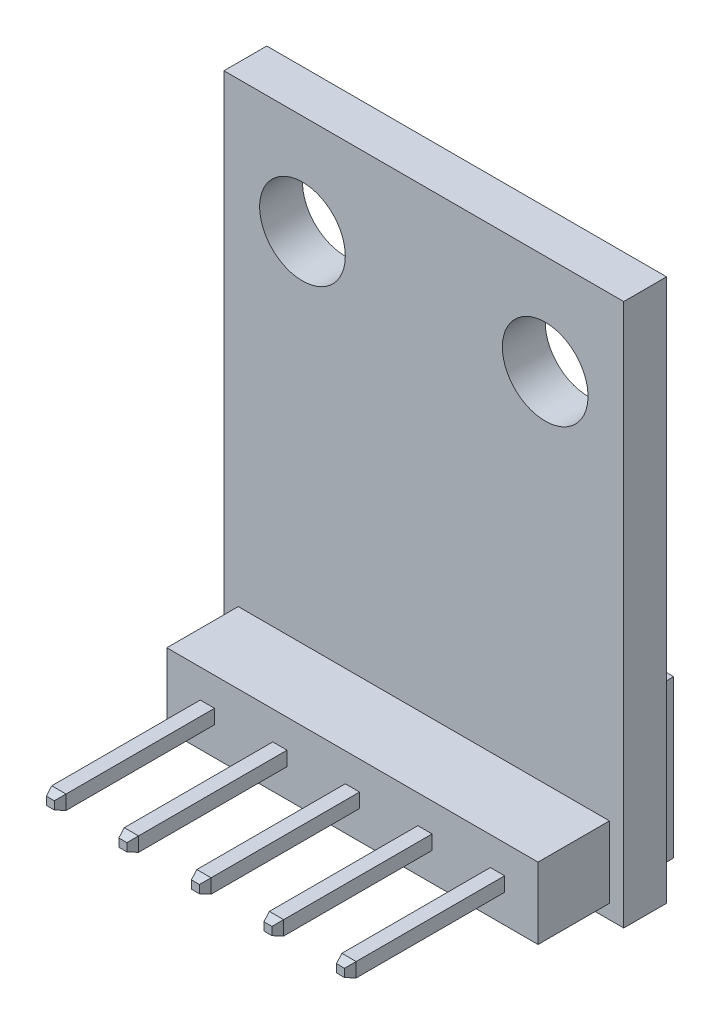
from build123d import *
from OCP.BRepFilletAPI import BRepFilletAPI_MakeChamfer

# Parameters (mm, degrees)
SKETCH2_W                     = 14
SKETCH2_H                     = 19
BOSS_EXTRUDE1_DEPTH           = 1.5
SKETCH3_R                     = 1.5
CUT_EXTRUDE1_DEPTH            = 12.895377253
SKETCH4_W                     = 13
SKETCH4_H                     = 2.5
BOSS_EXTRUDE2_DEPTH           = 2.5
SKETCH5_W                     = 0.5
SKETCH5_H                     = 0.5
BOSS_EXTRUDE3_DEPTH           = 5.5
CHAMFER1_SIZE                 = 0.3
CHAMFER1_SIZE2                = 0.10919107
SKETCH6_W                     = 12.5
SKETCH6_H                     = 5.5
SKETCH6_W_2                   = 4.5
SKETCH6_H_2                   = 1.5
SKETCH6_W_3                   = 2.5
SKETCH6_H_3                   = 1
KOPONENTTIEN_TILAVARAUS_DEPTH = 1


with BuildPart() as part:
    # Sketch2 → Boss-Extrude1 (new body)
    with BuildSketch(Plane.XY):
        Rectangle(SKETCH2_W, SKETCH2_H)
    extrude(amount=BOSS_EXTRUDE1_DEPTH)

    # Sketch3 → Cut-Extrude1 (cut, through all)
    with BuildSketch(Plane.XY.offset(1.5)):
        with Locations((-4.25, 6)):
            Circle(SKETCH3_R)
        with Locations(Location((4.25, 6, 0), (0, 0, 180))):
            Circle(SKETCH3_R)
    extrude(amount=-CUT_EXTRUDE1_DEPTH, mode=Mode.SUBTRACT)

    # Sketch4 → Boss-Extrude2 (add)
    with BuildSketch(Plane.XY.offset(1.5)):
        with Locations((0, -7.75)):
            Rectangle(SKETCH4_W, SKETCH4_H)
    extrude(amount=BOSS_EXTRUDE2_DEPTH)

    # Sketch5 → Boss-Extrude3 (add)
    with BuildSketch(Plane.XY.offset(4)):
        with Locations((-5.08, -7.75)):
            Rectangle(SKETCH5_W, SKETCH5_H)
        with Locations((-2.54, -7.75)):
            Rectangle(SKETCH5_W, SKETCH5_H)
        with Locations((0, -7.75)):
            Rectangle(SKETCH5_W, SKETCH5_H)
        with Locations((2.54, -7.75)):
            Rectangle(SKETCH5_W, SKETCH5_H)
        with Locations((5.08, -7.75)):
            Rectangle(SKETCH5_W, SKETCH5_H)
    extrude(amount=BOSS_EXTRUDE3_DEPTH)

    # Chamfer1: one chamfer whose edges measure the first distance from different faces: ONE call of the kernel's chamfer builder (chamfer() names one face for all edges)
    chamfer1_edges_1 = [part.edges().sort_by_distance(p)[0] for p in [
        (-4.83, -7.75, 9.5),
    ]]
    chamfer1_side_1 = [part.faces().sort_by_distance(p)[0] for p in [
        (-4.83, -7.75, 6.75),
    ]]
    chamfer1_edges_2 = [part.edges().sort_by_distance(p)[0] for p in [
        (-5.08, -7.5, 9.5),
    ]]
    chamfer1_side_2 = [part.faces().sort_by_distance(p)[0] for p in [
        (-5.08, -7.5, 6.75),
    ]]
    chamfer1_edges_3 = [part.edges().sort_by_distance(p)[0] for p in [
        (-5.33, -7.75, 9.5),
    ]]
    chamfer1_side_3 = [part.faces().sort_by_distance(p)[0] for p in [
        (-5.33, -7.75, 6.75),
    ]]
    chamfer1_edges_4 = [part.edges().sort_by_distance(p)[0] for p in [
        (-5.08, -8, 9.5),
    ]]
    chamfer1_side_4 = [part.faces().sort_by_distance(p)[0] for p in [
        (-5.08, -8, 6.75),
    ]]
    chamfer1_edges_5 = [part.edges().sort_by_distance(p)[0] for p in [
        (-2.29, -7.75, 9.5),
    ]]
    chamfer1_side_5 = [part.faces().sort_by_distance(p)[0] for p in [
        (-2.29, -7.75, 6.75),
    ]]
    chamfer1_edges_6 = [part.edges().sort_by_distance(p)[0] for p in [
        (-2.54, -7.5, 9.5),
    ]]
    chamfer1_side_6 = [part.faces().sort_by_distance(p)[0] for p in [
        (-2.54, -7.5, 6.75),
    ]]
    chamfer1_edges_7 = [part.edges().sort_by_distance(p)[0] for p in [
        (-2.79, -7.75, 9.5),
    ]]
    chamfer1_side_7 = [part.faces().sort_by_distance(p)[0] for p in [
        (-2.79, -7.75, 6.75),
    ]]
    chamfer1_edges_8 = [part.edges().sort_by_distance(p)[0] for p in [
        (-2.54, -8, 9.5),
    ]]
    chamfer1_side_8 = [part.faces().sort_by_distance(p)[0] for p in [
        (-2.54, -8, 6.75),
    ]]
    chamfer1_edges_9 = [part.edges().sort_by_distance(p)[0] for p in [
        (0.25, -7.75, 9.5),
    ]]
    chamfer1_side_9 = [part.faces().sort_by_distance(p)[0] for p in [
        (0.25, -7.75, 6.75),
    ]]
    chamfer1_edges_10 = [part.edges().sort_by_distance(p)[0] for p in [
        (0, -7.5, 9.5),
    ]]
    chamfer1_side_10 = [part.faces().sort_by_distance(p)[0] for p in [
        (0, -7.5, 6.75),
    ]]
    chamfer1_edges_11 = [part.edges().sort_by_distance(p)[0] for p in [
        (-0.25, -7.75, 9.5),
    ]]
    chamfer1_side_11 = [part.faces().sort_by_distance(p)[0] for p in [
        (-0.25, -7.75, 6.75),
    ]]
    chamfer1_edges_12 = [part.edges().sort_by_distance(p)[0] for p in [
        (0, -8, 9.5),
    ]]
    chamfer1_side_12 = [part.faces().sort_by_distance(p)[0] for p in [
        (0, -8, 6.75),
    ]]
    chamfer1_edges_13 = [part.edges().sort_by_distance(p)[0] for p in [
        (2.79, -7.75, 9.5),
    ]]
    chamfer1_side_13 = [part.faces().sort_by_distance(p)[0] for p in [
        (2.79, -7.75, 6.75),
    ]]
    chamfer1_edges_14 = [part.edges().sort_by_distance(p)[0] for p in [
        (2.54, -7.5, 9.5),
    ]]
    chamfer1_side_14 = [part.faces().sort_by_distance(p)[0] for p in [
        (2.54, -7.5, 6.75),
    ]]
    chamfer1_edges_15 = [part.edges().sort_by_distance(p)[0] for p in [
        (2.29, -7.75, 9.5),
    ]]
    chamfer1_side_15 = [part.faces().sort_by_distance(p)[0] for p in [
        (2.29, -7.75, 6.75),
    ]]
    chamfer1_edges_16 = [part.edges().sort_by_distance(p)[0] for p in [
        (2.54, -8, 9.5),
    ]]
    chamfer1_side_16 = [part.faces().sort_by_distance(p)[0] for p in [
        (2.54, -8, 6.75),
    ]]
    chamfer1_edges_17 = [part.edges().sort_by_distance(p)[0] for p in [
        (5.33, -7.75, 9.5),
    ]]
    chamfer1_side_17 = [part.faces().sort_by_distance(p)[0] for p in [
        (5.33, -7.75, 6.75),
    ]]
    chamfer1_edges_18 = [part.edges().sort_by_distance(p)[0] for p in [
        (5.08, -7.5, 9.5),
    ]]
    chamfer1_side_18 = [part.faces().sort_by_distance(p)[0] for p in [
        (5.08, -7.5, 6.75),
    ]]
    chamfer1_edges_19 = [part.edges().sort_by_distance(p)[0] for p in [
        (4.83, -7.75, 9.5),
    ]]
    chamfer1_side_19 = [part.faces().sort_by_distance(p)[0] for p in [
        (4.83, -7.75, 6.75),
    ]]
    chamfer1_edges_20 = [part.edges().sort_by_distance(p)[0] for p in [
        (5.08, -8, 9.5),
    ]]
    chamfer1_side_20 = [part.faces().sort_by_distance(p)[0] for p in [
        (5.08, -8, 6.75),
    ]]
    chamfer1 = BRepFilletAPI_MakeChamfer(part.part.solid().wrapped)
    for e in chamfer1_edges_1:
        chamfer1.Add(CHAMFER1_SIZE, CHAMFER1_SIZE2, e.wrapped, chamfer1_side_1[0].wrapped)  # the first distance lies on this face
    for e in chamfer1_edges_2:
        chamfer1.Add(CHAMFER1_SIZE, CHAMFER1_SIZE2, e.wrapped, chamfer1_side_2[0].wrapped)  # the first distance lies on this face
    for e in chamfer1_edges_3:
        chamfer1.Add(CHAMFER1_SIZE, CHAMFER1_SIZE2, e.wrapped, chamfer1_side_3[0].wrapped)  # the first distance lies on this face
    for e in chamfer1_edges_4:
        chamfer1.Add(CHAMFER1_SIZE, CHAMFER1_SIZE2, e.wrapped, chamfer1_side_4[0].wrapped)  # the first distance lies on this face
    for e in chamfer1_edges_5:
        chamfer1.Add(CHAMFER1_SIZE, CHAMFER1_SIZE2, e.wrapped, chamfer1_side_5[0].wrapped)  # the first distance lies on this face
    for e in chamfer1_edges_6:
        chamfer1.Add(CHAMFER1_SIZE, CHAMFER1_SIZE2, e.wrapped, chamfer1_side_6[0].wrapped)  # the first distance lies on this face
    for e in chamfer1_edges_7:
        chamfer1.Add(CHAMFER1_SIZE, CHAMFER1_SIZE2, e.wrapped, chamfer1_side_7[0].wrapped)  # the first distance lies on this face
    for e in chamfer1_edges_8:
        chamfer1.Add(CHAMFER1_SIZE, CHAMFER1_SIZE2, e.wrapped, chamfer1_side_8[0].wrapped)  # the first distance lies on this face
    for e in chamfer1_edges_9:
        chamfer1.Add(CHAMFER1_SIZE, CHAMFER1_SIZE2, e.wrapped, chamfer1_side_9[0].wrapped)  # the first distance lies on this face
    for e in chamfer1_edges_10:
        chamfer1.Add(CHAMFER1_SIZE, CHAMFER1_SIZE2, e.wrapped, chamfer1_side_10[0].wrapped)  # the first distance lies on this face
    for e in chamfer1_edges_11:
        chamfer1.Add(CHAMFER1_SIZE, CHAMFER1_SIZE2, e.wrapped, chamfer1_side_11[0].wrapped)  # the first distance lies on this face
    for e in chamfer1_edges_12:
        chamfer1.Add(CHAMFER1_SIZE, CHAMFER1_SIZE2, e.wrapped, chamfer1_side_12[0].wrapped)  # the first distance lies on this face
    for e in chamfer1_edges_13:
        chamfer1.Add(CHAMFER1_SIZE, CHAMFER1_SIZE2, e.wrapped, chamfer1_side_13[0].wrapped)  # the first distance lies on this face
    for e in chamfer1_edges_14:
        chamfer1.Add(CHAMFER1_SIZE, CHAMFER1_SIZE2, e.wrapped, chamfer1_side_14[0].wrapped)  # the first distance lies on this face
    for e in chamfer1_edges_15:
        chamfer1.Add(CHAMFER1_SIZE, CHAMFER1_SIZE2, e.wrapped, chamfer1_side_15[0].wrapped)  # the first distance lies on this face
    for e in chamfer1_edges_16:
        chamfer1.Add(CHAMFER1_SIZE, CHAMFER1_SIZE2, e.wrapped, chamfer1_side_16[0].wrapped)  # the first distance lies on this face
    for e in chamfer1_edges_17:
        chamfer1.Add(CHAMFER1_SIZE, CHAMFER1_SIZE2, e.wrapped, chamfer1_side_17[0].wrapped)  # the first distance lies on this face
    for e in chamfer1_edges_18:
        chamfer1.Add(CHAMFER1_SIZE, CHAMFER1_SIZE2, e.wrapped, chamfer1_side_18[0].wrapped)  # the first distance lies on this face
    for e in chamfer1_edges_19:
        chamfer1.Add(CHAMFER1_SIZE, CHAMFER1_SIZE2, e.wrapped, chamfer1_side_19[0].wrapped)  # the first distance lies on this face
    for e in chamfer1_edges_20:
        chamfer1.Add(CHAMFER1_SIZE, CHAMFER1_SIZE2, e.wrapped, chamfer1_side_20[0].wrapped)  # the first distance lies on this face
    add(Compound.cast(chamfer1.Shape()), mode=Mode.REPLACE)

    # Sketch6 → Koponenttien tilavaraus (add)
    with BuildSketch(Plane(origin=(0, 0, 0), x_dir=(-1, 0, 0), z_dir=(0, 0, -1))):
        with Locations((0, -6.25)):
            Rectangle(SKETCH6_W, SKETCH6_H)
        with Locations((0, 1.75)):
            Rectangle(SKETCH6_W_2, SKETCH6_H_2)
        with Locations((0, 6)):
            Rectangle(SKETCH6_W_3, SKETCH6_H_3)
        with Locations((0, 4.5)):
            Rectangle(SKETCH6_W_3, SKETCH6_H_3)
    extrude(amount=KOPONENTTIEN_TILAVARAUS_DEPTH)


solid = part.part
